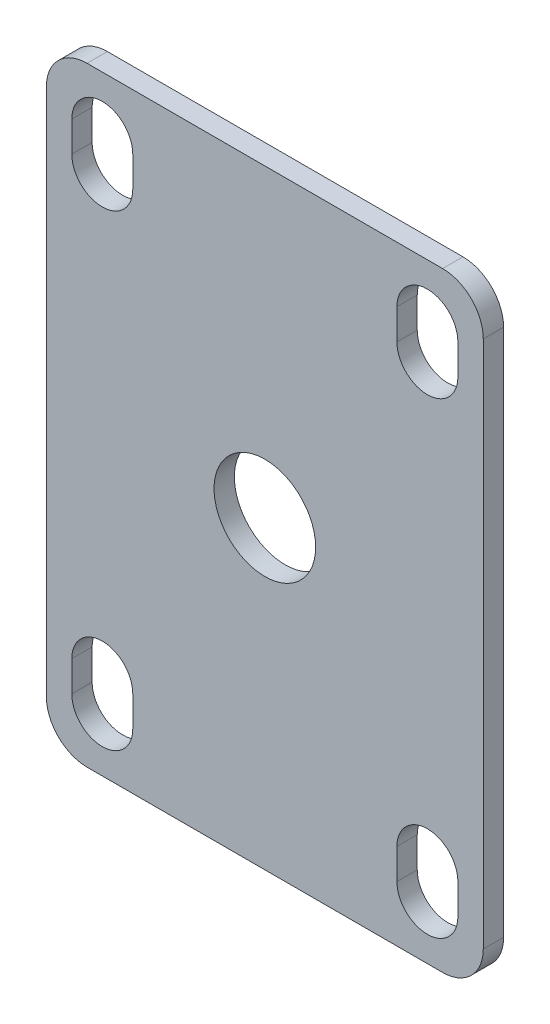
from build123d import *

# Parameters (mm, degrees)
SKETCH1_R           = 5
BOSS_EXTRUDE1_DEPTH = 2


with BuildPart() as part:
    # Sketch1 → Boss-Extrude1 (new body)
    with BuildSketch(Plane.XY):
        with BuildLine():
            Line((4, 0), (39, 0))
            ThreePointArc((39, 0), (41.828427125, 1.171572875), (43, 4))
            Line((43, 4), (43, 56))
            ThreePointArc((43, 56), (41.828427125, 58.828427125), (39, 60))
            Line((39, 60), (4, 60))
            ThreePointArc((4, 60), (1.171572875, 58.828427125), (0, 56))
            Line((0, 56), (0, 4))
            ThreePointArc((0, 4), (1.171572875, 1.171572875), (4, 0))
        make_face()
        with Locations((21.5, 30)):
            Circle(SKETCH1_R, mode=Mode.SUBTRACT)
        with BuildLine():
            Line((40.5, 8.5), (40.5, 5.5))
            ThreePointArc((40.5, 5.5), (37.5, 2.5), (34.5, 5.5))
            Line((34.5, 5.5), (34.5, 8.5))
            ThreePointArc((34.5, 8.5), (37.5, 11.5), (40.5, 8.5))
        make_face(mode=Mode.SUBTRACT)
        with BuildLine():
            Line((40.5, 51.5), (40.5, 54.5))
            ThreePointArc((40.5, 54.5), (37.5, 57.5), (34.5, 54.5))
            Line((34.5, 54.5), (34.5, 51.5))
            ThreePointArc((34.5, 51.5), (37.5, 48.5), (40.5, 51.5))
        make_face(mode=Mode.SUBTRACT)
        with BuildLine():
            Line((2.5, 8.5), (2.5, 5.5))
            ThreePointArc((2.5, 5.5), (5.5, 2.5), (8.5, 5.5))
            Line((8.5, 5.5), (8.5, 8.5))
            ThreePointArc((8.5, 8.5), (5.5, 11.5), (2.5, 8.5))
        make_face(mode=Mode.SUBTRACT)
        with BuildLine():
            Line((2.5, 51.5), (2.5, 54.5))
            ThreePointArc((2.5, 54.5), (5.5, 57.5), (8.5, 54.5))
            Line((8.5, 54.5), (8.5, 51.5))
            ThreePointArc((8.5, 51.5), (5.5, 48.5), (2.5, 51.5))
        make_face(mode=Mode.SUBTRACT)
    extrude(amount=BOSS_EXTRUDE1_DEPTH)


solid = part.part
